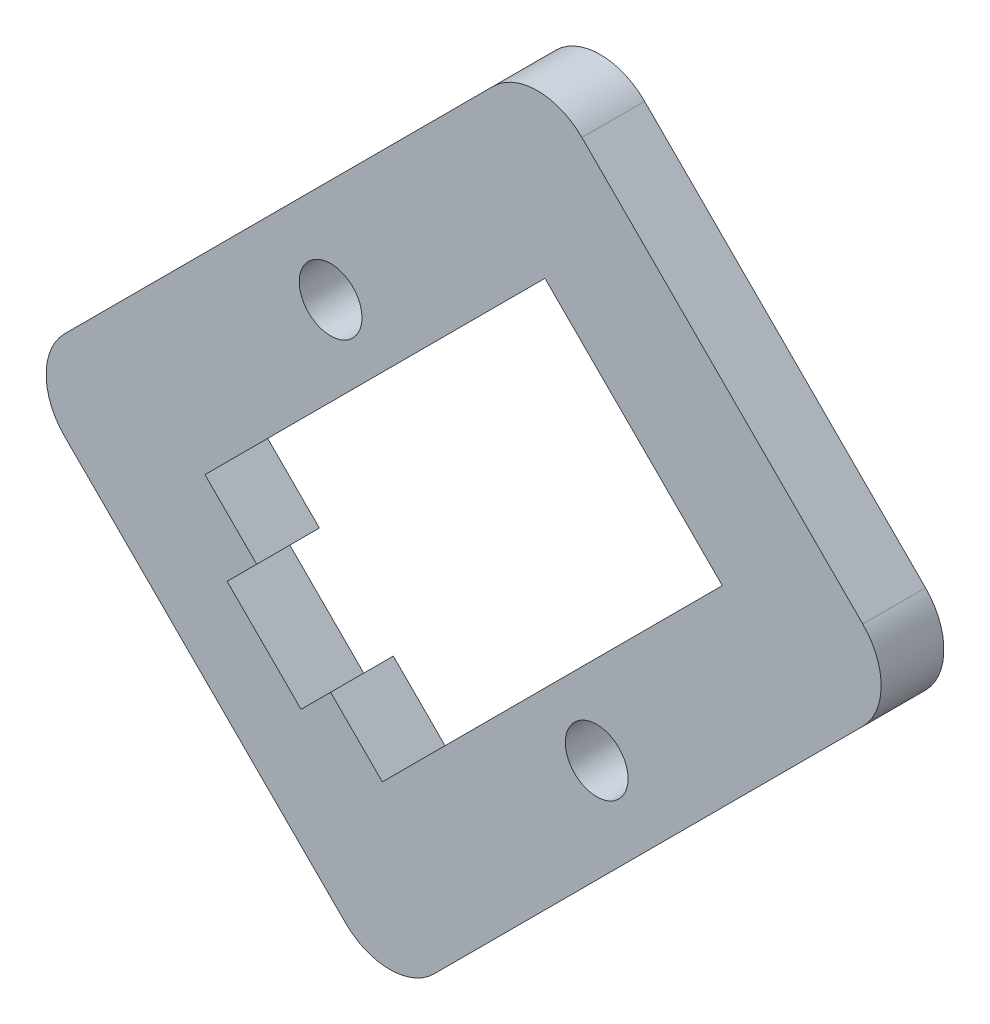
from build123d import *

# Parameters (mm, degrees)
SKETCH_1_R      = 1.500000002
EXTRUDE_1_DEPTH = 3


with BuildPart() as part:
    # 草圖1 → 填料-伸長1 (new body)
    with BuildSketch(Plane.XY):
        with BuildLine():
            Line((80.093950814, 24.90807964), (100.600047468, 45.414176295))
            ThreePointArc((100.600047468, 45.414176295), (101.478727125, 47.535496638), (100.600047468, 49.656816982))
            Line((100.600047468, 49.656816982), (87.165018626, 63.091845824))
            ThreePointArc((87.165018626, 63.091845824), (85.043698282, 63.970525481), (82.922377939, 63.091845824))
            Line((82.922377939, 63.091845824), (62.416281284, 42.58574917))
            ThreePointArc((62.416281284, 42.58574917), (61.537601628, 40.464428826), (62.416281284, 38.343108483))
            Line((62.416281284, 38.343108483), (75.851310127, 24.90807964))
            ThreePointArc((75.851310127, 24.90807964), (77.97263047, 24.029399984), (80.093950814, 24.90807964))
        make_face()
        with Locations((75.144203348, 50.363923763)):
            Circle(SKETCH_1_R, mode=Mode.SUBTRACT)
        with Locations((87.872125409, 37.636001701)):
            Circle(SKETCH_1_R, mode=Mode.SUBTRACT)
        Polygon((75.144203346, 34.100467796), (77.61907708, 31.625594061), (93.882533047, 47.889050029), (85.397251673, 56.374331403), (69.133795706, 40.110875436), (71.60866944, 37.636001701), (70.194385167, 36.221717428), (73.729919073, 32.686183523), align=None, mode=Mode.SUBTRACT)
    extrude(amount=EXTRUDE_1_DEPTH)


solid = part.part
